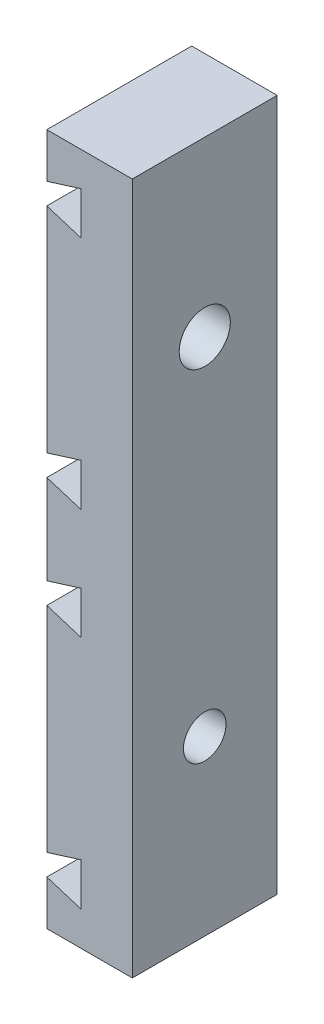
from build123d import *

# Parameters (mm, degrees)
SALIENTE_EXTRUIR1_DEPTH    = 8.5
CROQUIS2_R                 = 1.25
CORTAR_EXTRUIR1_DEPTH      = 8.5
CROQUIS3_R                 = 3
CORTAR_EXTRUIR2_DEPTH      = 2.5
CORTAR_EXTRUIR3_DEPTH      = 33.009517698
CORTAR_EXTRUIR3_DEPTH_BACK = 33.009517698
CROQUIS4_R                 = 1.5
CROQUIS5_R                 = 3
CORTAR_EXTRUIR4_DEPTH      = 2.5


with BuildPart() as part:
    # Croquis1 → Saliente-Extruir1 (new body)
    with BuildSketch(Plane.XY):
        Polygon((12.15, 8.15), (12.15, 5.65), (10.15, 6.275), (10.15, -6.275), (12.15, -5.65), (12.15, -8.15), (10.15, -7.525), (10.15, -10.15), (15.165647838, -10.15), (15.165647838, 10.15), (10.15, 10.15), (10.15, 7.525), align=None)
    saliente_extruir1 = extrude(amount=SALIENTE_EXTRUIR1_DEPTH)

    # Croquis2 → Cortar-Extruir1 (cut)
    with BuildSketch(Plane.ZY.offset(-10.15)):
        with Locations((4.25, 0)):
            Circle(CROQUIS2_R)
    extrude(amount=-CORTAR_EXTRUIR1_DEPTH, mode=Mode.SUBTRACT)

    # Croquis3 → Cortar-Extruir2 (cut)
    with BuildSketch(Plane.ZY.offset(-10.15)):
        with Locations((4.25, 0)):
            Circle(CROQUIS3_R)
    extrude(amount=-CORTAR_EXTRUIR2_DEPTH, mode=Mode.SUBTRACT)

    # Simetría1: Saliente-Extruir1 across plane
    add(saliente_extruir1.mirror(Plane(origin=(10.15, 10.15, 8.5), x_dir=(0, 0, 1), z_dir=(0, -1, 0))))

    # Croquis4 → Cortar-Extruir3 (cut, two sides: drawn at the far end of the back side and taken through both)
    with BuildSketch(Plane.ZY.offset(-10.15).offset(-CORTAR_EXTRUIR3_DEPTH_BACK)):
        with Locations((4.25, 20.3)):
            Circle(CROQUIS4_R)
    extrude(amount=CORTAR_EXTRUIR3_DEPTH + CORTAR_EXTRUIR3_DEPTH_BACK, mode=Mode.SUBTRACT)

    # Croquis5 → Cortar-Extruir4 (cut)
    with BuildSketch(Plane.ZY.offset(-10.15)):
        with Locations((4.25, 20.3)):
            Circle(CROQUIS5_R)
    extrude(amount=-CORTAR_EXTRUIR4_DEPTH, mode=Mode.SUBTRACT)


solid = part.part
